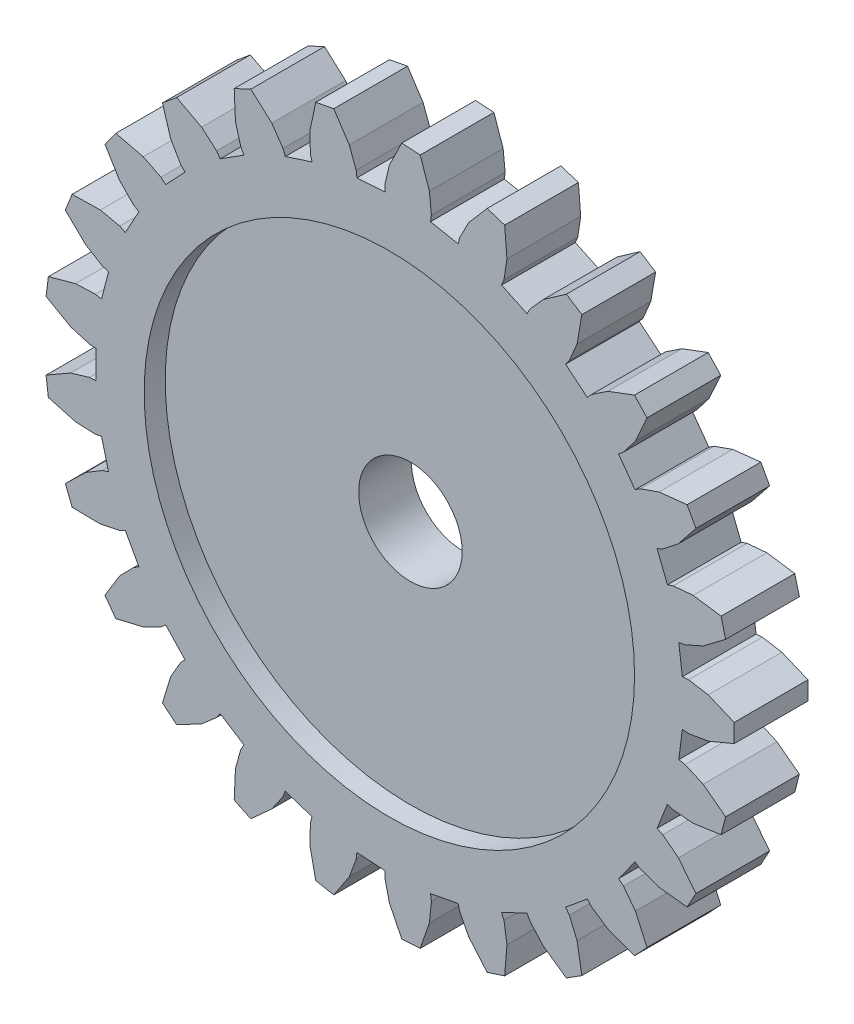
from build123d import *

# Parameters (mm, degrees)
MODEL_R             = 23.276712062
BOSS_EXTRUDE2_DEPTH = 7
MODEL_4_R           = 23.276712062
MODEL_4_R_2         = 4.9115955
BOSS_EXTRUDE3_DEPTH = 5


with BuildPart() as part:
    # Model → Boss-Extrude2 (new body)
    with BuildSketch(Plane.XY):
        Polygon((123.341113, 141.084891), (122.745856, 141.038525), (122.410875, 143.690155), (122.998964, 143.793282), (124.71858, 144.553591), (126.858206, 146.167273), (126.424061, 147.858157), (123.771694, 148.241465), (121.8985, 148.079298), (121.333474, 147.886354), (120.349586, 150.371374), (120.893552, 150.617508), (122.370063, 151.781585), (124.041162, 153.876673), (123.200152, 155.406467), (120.535787, 155.118115), (118.761775, 154.495199), (118.262485, 154.167799), (116.691506, 156.330064), (117.15717, 156.703746), (118.297799, 158.198443), (119.395373, 160.643298), (118.200337, 161.91588), (115.691392, 160.973986), (114.128025, 159.929462), (113.725839, 159.488179), (111.666486, 161.191825), (112.024589, 161.669573), (112.757667, 163.400973), (113.212747, 166.041974), (111.738777, 166.977383), (109.542893, 165.441132), (108.288404, 164.040627), (108.008598, 163.51319), (105.590261, 164.651172), (105.818305, 165.20297), (106.09777, 167.062284), (105.881763, 169.733483), (104.221475, 170.272946), (102.476627, 168.238863), (101.609844, 166.570382), (101.469994, 165.98993), (98.844631, 166.490744), (98.928281, 167.081915), (98.736576, 168.952318), (97.863053, 171.485877), (96.120768, 171.595493), (94.936595, 169.191391), (94.511978, 167.359766), (94.520868, 166.762773), (91.853436, 166.594952), (91.787441, 167.188353), (91.136605, 168.952318), (89.660456, 171.189045), (87.945649, 170.861929), (87.396554, 168.238863), (87.440781, 166.359184), (87.597866, 165.783157), (85.055972, 164.957248), (84.844478, 165.515593), (83.775412, 167.062284), (81.789386, 168.861637), (80.209802, 168.118343), (80.330288, 165.441132), (80.840586, 163.631506), (81.135988, 163.11264), (78.879347, 161.680535), (78.53564, 162.168743), (77.115515, 163.400973), (74.744402, 164.649894), (73.399294, 163.537122), (74.181789, 160.973986), (75.126091, 159.348118), (75.541248, 158.919019), (73.711655, 156.9707), (73.257334, 157.358095), (71.575382, 158.198443), (68.968168, 158.818454), (67.942054, 157.40613), (69.337394, 155.118115), (70.656363, 153.778166), (71.165189, 153.465791), (69.877604, 151.123682), (69.341215, 151.38592), (67.503119, 151.781585), (64.823625, 151.733728), (64.18098, 150.110589), (66.101488, 148.241465), (67.712251, 147.271626), (68.282778, 147.095606), (67.618102, 144.506869), (67.033349, 144.627477), (65.154601, 144.553591), (62.57119, 143.840876), (62.352394, 142.108912), (64.677397, 140.77612), (66.478745, 140.23733), (67.075121, 140.208727), (67.075121, 137.53602), (66.478745, 137.507417), (64.677397, 136.968626), (62.352394, 135.635835), (62.57119, 133.903871), (65.154601, 133.191155), (67.033349, 133.11727), (67.618102, 133.237877), (68.282778, 130.64914), (67.712251, 130.473121), (66.101488, 129.503281), (64.18098, 127.634157), (64.823625, 126.011018), (67.503119, 125.963162), (69.341215, 126.358826), (69.877604, 126.621064), (71.165189, 124.278956), (70.656363, 123.966581), (69.337394, 122.626632), (67.942054, 120.338617), (68.968168, 118.926292), (71.575382, 119.546304), (73.257334, 120.386651), (73.711655, 120.774046), (75.541248, 118.825728), (75.126091, 118.396629), (74.181789, 116.770761), (73.399294, 114.207624), (74.744402, 113.094853), (77.115515, 114.343774), (78.53564, 115.576004), (78.879347, 116.064212), (81.135988, 114.632106), (80.840586, 114.113241), (80.330288, 112.303615), (80.209802, 109.626404), (81.789386, 108.88311), (83.775412, 110.682463), (84.844478, 112.229153), (85.055972, 112.787499), (87.597866, 111.96159), (87.440781, 111.385563), (87.396554, 109.505884), (87.945649, 106.882818), (89.660456, 106.555702), (91.136605, 108.792429), (91.787441, 110.556394), (91.853436, 111.149795), (94.520868, 110.981974), (94.511978, 110.384981), (94.936595, 108.553356), (96.120768, 106.149254), (97.863053, 106.258869), (98.736576, 108.792429), (98.928281, 110.662831), (98.844631, 111.254002), (101.469994, 111.754817), (101.609844, 111.174365), (102.476627, 109.505884), (104.221475, 107.471801), (105.881763, 108.011263), (106.09777, 110.682463), (105.818305, 112.541777), (105.590261, 113.093575), (108.008598, 114.231557), (108.288404, 113.70412), (109.542893, 112.303615), (111.738777, 110.767364), (113.212747, 111.702772), (112.757667, 114.343774), (112.024589, 116.075173), (111.666486, 116.552922), (113.725839, 118.256568), (114.128025, 117.815285), (115.691392, 116.770761), (118.200337, 115.828867), (119.395373, 117.101449), (118.297799, 119.546304), (117.15717, 121.041), (116.691506, 121.414682), (118.262485, 123.576948), (118.761775, 123.249547), (120.535787, 122.626632), (123.200152, 122.33828), (124.041162, 123.868074), (122.370063, 125.963162), (120.893552, 127.127238), (120.349586, 127.373373), (121.333474, 129.858393), (121.8985, 129.665449), (123.771694, 129.503281), (126.424061, 129.88659), (126.858206, 131.577474), (124.71858, 133.191155), (122.998964, 133.951465), (122.410875, 134.054592), (122.745856, 136.706222), (123.341113, 136.659856), (125.195784, 136.968626), (127.669499, 137.999508), (127.669499, 139.745239), (125.195784, 140.77612), align=None)
        with Locations((94.936592, 138.8723735)):
            Circle(MODEL_R, mode=Mode.SUBTRACT)
    extrude(amount=BOSS_EXTRUDE2_DEPTH)

    # Model<4> → Boss-Extrude3 (add)
    with BuildSketch(Plane.XY):
        with Locations((94.936592, 138.8723735)):
            Circle(MODEL_4_R)
        with Locations((94.936592, 138.8723735)):
            Circle(MODEL_4_R_2, mode=Mode.SUBTRACT)
    extrude(amount=BOSS_EXTRUDE3_DEPTH)


solid = part.part
